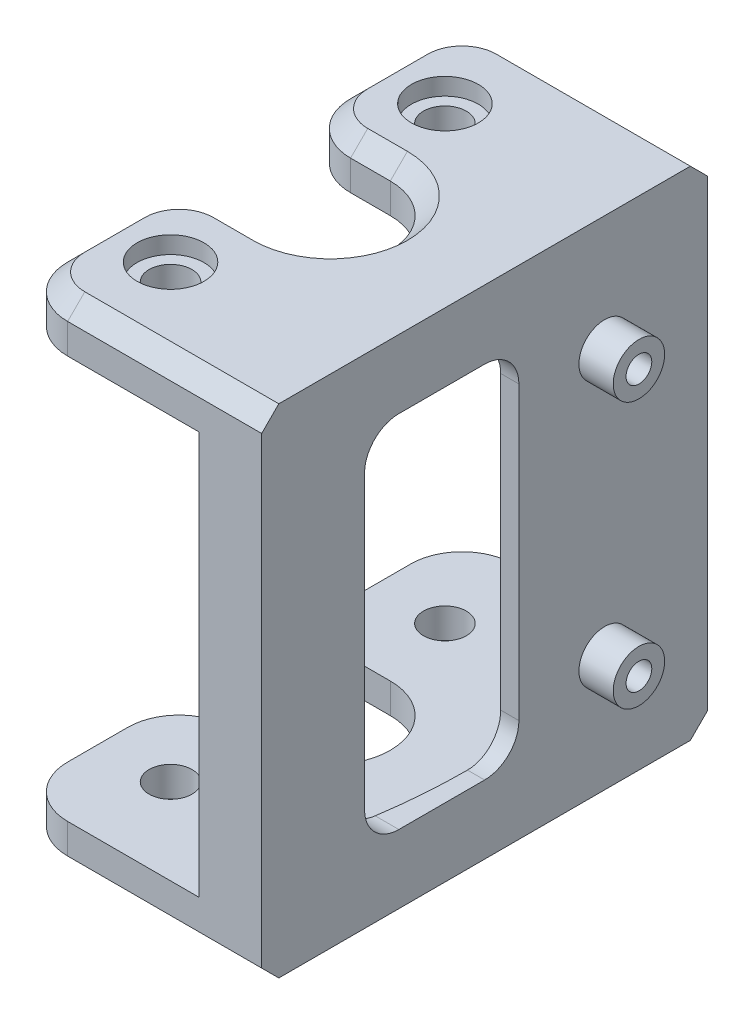
from build123d import *

# Parameters (mm, degrees)
SKETCH_1_R          = 1.25
EXTRUDE_1_DEPTH     = 14.5
SKETCH_2_R          = 33
CUT_EXTRUDE_1_DEPTH = 11.75
SKETCH_3_R          = 0.75
SKETCH_3_W          = 9
SKETCH_3_H          = 21
CUT_EXTRUDE_2_DEPTH = 25.169333236
EXTRUDE_START       = 2
SKETCH_4_R          = 1.5
SKETCH_4_R_2        = 0.75
EXTRUDE_2_DEPTH     = 2
FILLET_1_R          = 2
FILLET_2_R          = 3
CHAMFER_1_SIZE      = 1
SKETCH_5_R          = 1.95
CUT_EXTRUDE_3_DEPTH = 1


with BuildPart() as part:
    # Эскиз1 → Бобышка-Вытянуть1 (new, symmetric)
    with BuildSketch(Plane(origin=(0, 0, 0), x_dir=(1, 0, 0), z_dir=(0, 1, 0))):
        with BuildLine():
            Line((34, 13), (19.685438565, 13))
            Line((19.685438565, 13), (19.685438565, 3.5))
            Line((19.685438565, 3.5), (25, 3.5))
            ThreePointArc((25, 3.5), (27.474873734, 2.474873734), (28.5, 0))
            ThreePointArc((28.5, 0), (27.474873734, -2.474873734), (25, -3.5))
            Line((25, -3.5), (19.685438565, -3.5))
            Line((19.685438565, -3.5), (19.685438565, -13))
            Line((19.685438565, -13), (34, -13))
            Line((34, -13), (34, 13))
        make_face()
        with Locations(Location((23.685438565, -8, 0), (0, 0, 90))):
            Circle(SKETCH_1_R, mode=Mode.SUBTRACT)
        with Locations(Location((23.685438565, 8, 0), (0, 0, 90))):
            Circle(SKETCH_1_R, mode=Mode.SUBTRACT)
    extrude(amount=EXTRUDE_1_DEPTH, both=True)

    # Эскиз2 → Вырез-Вытянуть1 (cut, symmetric)
    with BuildSketch(Plane(origin=(0, 0, 0), x_dir=(1, 0, 0), z_dir=(0, 1, 0))):
        Circle(SKETCH_2_R)
    extrude(amount=CUT_EXTRUDE_1_DEPTH, both=True, mode=Mode.SUBTRACT)

    # Эскиз3 → Вырез-Вытянуть2 (cut, through all)
    with BuildSketch(Plane(origin=(34, 0, 0), x_dir=(0, 0, -1), z_dir=(1, 0, 0))):
        with Locations((7, 7.75)):
            Circle(SKETCH_3_R)
        with Locations((7, -7.75)):
            Circle(SKETCH_3_R)
        with Locations((-2.5, 0)):
            Rectangle(SKETCH_3_W, SKETCH_3_H)
    extrude(amount=-CUT_EXTRUDE_2_DEPTH, mode=Mode.SUBTRACT)

    # Эскиз4 → Бобышка-Вытянуть2 (add)
    # profile 1 of 2: a face of its own
    with BuildSketch(Plane(origin=(34, 0, 0), x_dir=(0, 0, -1), z_dir=(1, 0, 0)).offset(EXTRUDE_START)):
        with Locations((7, 7.75)):
            Circle(SKETCH_4_R)
        with Locations((7, 7.75)):
            Circle(SKETCH_4_R_2, mode=Mode.SUBTRACT)
    # profile 2 of 2: a face of its own
    with BuildSketch(Plane(origin=(34, 0, 0), x_dir=(0, 0, -1), z_dir=(1, 0, 0)).offset(EXTRUDE_START)):
        with Locations((7, -7.75)):
            Circle(SKETCH_4_R)
        with Locations((7, -7.75)):
            Circle(SKETCH_4_R_2, mode=Mode.SUBTRACT)
    extrude(amount=-EXTRUDE_2_DEPTH)

    # Скругление1
    fillet_1_edges = [part.edges().sort_by_distance(p)[0] for p in [
        (33.469669092, 10.5, -2),
        (33.469669092, -10.5, -2),
        (33.124515497, -10.5, 7),
        (33.124515497, 10.5, 7),
    ]]
    fillet(fillet_1_edges, radius=FILLET_1_R)

    # Скругление2
    fillet_2_edges = [part.edges().sort_by_distance(p)[0] for p in [
        (19.685438565, 13.125, -3.5),
        (19.685438565, 13.125, -13),
        (19.685438565, 13.125, 13),
        (19.685438565, 13.125, 3.5),
        (19.685438565, -13.125, -3.5),
        (19.685438565, -13.125, -13),
        (19.685438565, -13.125, 13),
        (19.685438565, -13.125, 3.5),
    ]]
    fillet(fillet_2_edges, radius=FILLET_2_R)

    # Фаска1
    chamfer_1_edges = [part.edges().sort_by_distance(p)[0] for p in [
        (19.685438565, -14.5, -8.25),
        (23.842719282, 14.5, 3.5),
        (23.842719282, -14.5, -3.5),
        (28.342719282, -14.5, -13),
        (28.342719282, -14.5, 13),
        (19.685438565, -14.5, 8.25),
        (20.564118221, -14.5, 12.121320344),
        (20.564118221, -14.5, 4.378679656),
        (20.564118221, -14.5, -4.378679656),
        (20.564118221, -14.5, -12.121320344),
        (28.342719282, 14.5, -13),
        (28.342719282, 14.5, 13),
        (19.685438565, 14.5, -8.25),
        (19.685438565, 14.5, 8.25),
        (20.564118221, 14.5, 12.121320344),
        (20.564118221, 14.5, 4.378679656),
        (20.564118221, 14.5, -4.378679656),
        (20.564118221, 14.5, -12.121320344),
        (23.842719282, -14.5, 3.5),
        (28.5, -14.5, 0),
        (23.842719282, 14.5, -3.5),
        (28.5, 14.5, 0),
    ]]
    chamfer(chamfer_1_edges, length=CHAMFER_1_SIZE)

    # Эскиз5 → Вырез-Вытянуть3 (cut)
    with BuildSketch(Plane(origin=(0, 14.5, 0), x_dir=(1, 0, 0), z_dir=(0, 1, 0))):
        with Locations(Location((23.685438565, -8, 0), (0, 0, 270))):
            Circle(SKETCH_5_R)
        with Locations(Location((23.685438565, 8, 0), (0, 0, 270))):
            Circle(SKETCH_5_R)
    cut_extrude_3 = extrude(amount=-CUT_EXTRUDE_3_DEPTH, mode=Mode.SUBTRACT)

    # Зеркальное отражение1: Вырез-Вытянуть3 across plane
    add(cut_extrude_3.mirror(Plane.ZX), mode=Mode.SUBTRACT)


solid = part.part
